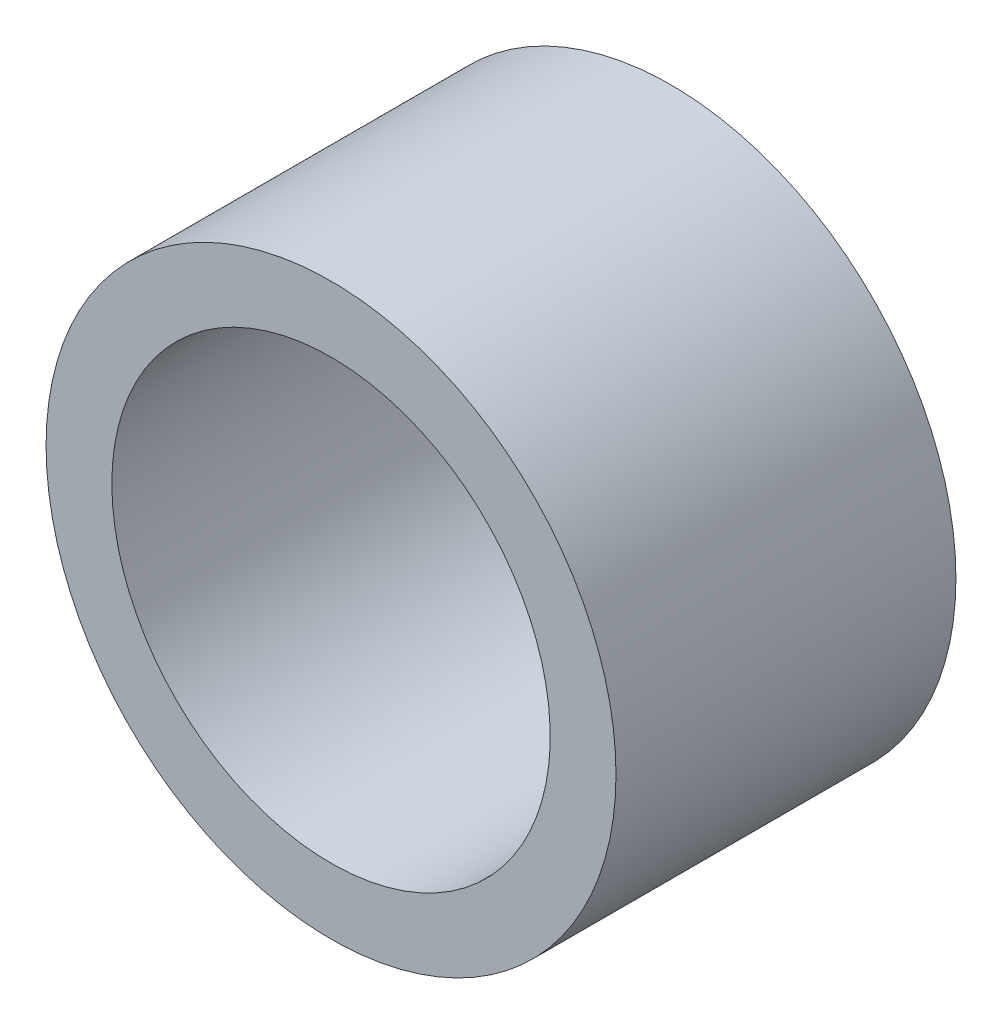
from build123d import *

# Parameters (mm, degrees)
SKETCH2_W = 19.05
SKETCH2_H = 98.473846154


with BuildPart() as part:
    # Sketch2 → Revolve1 (revolve)
    with BuildSketch(Plane.YZ, mode=Mode.PRIVATE) as revolve1_sk:
        with Locations((-73.025, 49.236923077)):
            Rectangle(SKETCH2_W, SKETCH2_H)
    revolve(revolve1_sk.sketch.rotate(Axis((0, 0, 0), (0, 0, 1)), 270), axis=Axis((0, 0, 0), (0, 0, 1)))


solid = part.part
